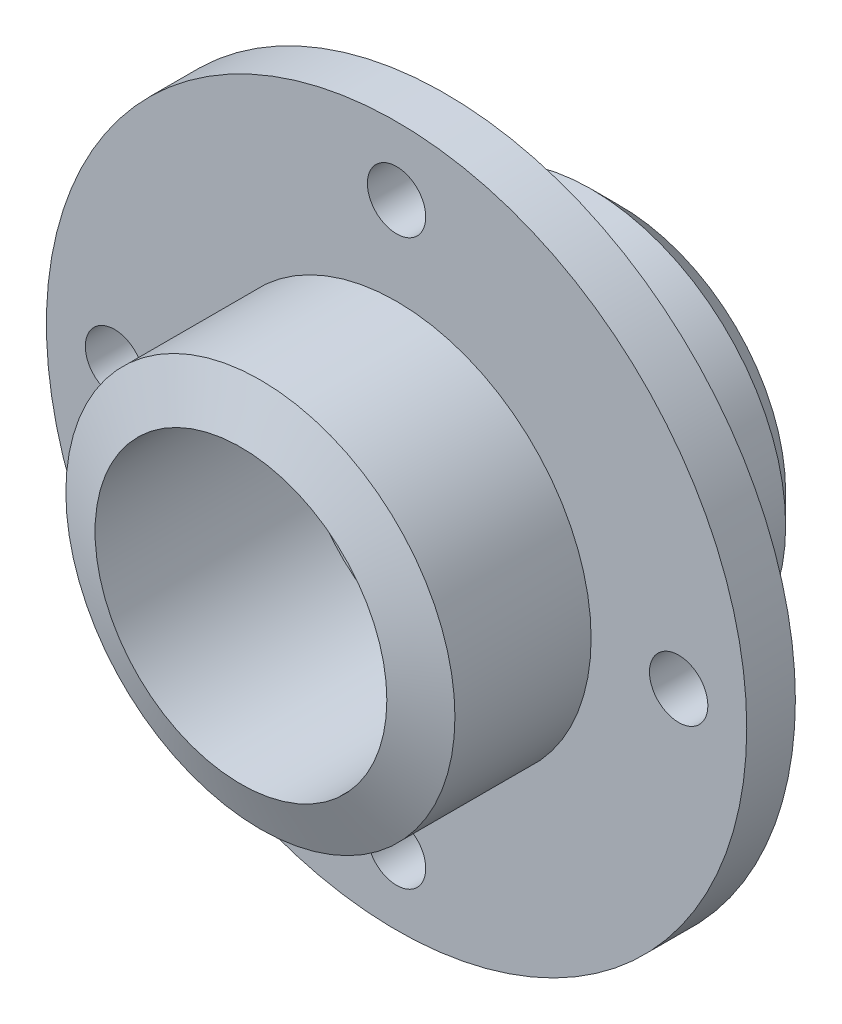
from build123d import *

# Parameters (mm, degrees)
CUT_EXTRUDE1_DEPTH      = 111.145358504
CUT_EXTRUDE1_DEPTH_BACK = 111.145358504
SKETCH2_R               = 6


with BuildPart() as part:
    # Sketch1 → Revolve1 (revolve)
    with BuildSketch(Plane(origin=(0, 0, 0), x_dir=(1, 0, 0), z_dir=(0, 1, 0))):
        Polygon((24, 78), (24, 72), (34, 72), (34, 42), (30, 42), (30, 0), (40, 4), (40, 32), (72, 32), (72, 42), (40, 42), (40, 72), (34, 78), align=None)
    revolve(axis=Axis((0, 0, 0), (0, 0, -1)))

    # Sketch2 → Cut-Extrude1 (cut, two sides: drawn at the far end of the back side and taken through both)
    with BuildSketch(Plane(origin=(0, 0, -42), x_dir=(-1, 0, 0), z_dir=(0, 0, -1)).offset(-CUT_EXTRUDE1_DEPTH_BACK)):
        with Locations((0, 58)):
            Circle(SKETCH2_R)
        with Locations((58, 0)):
            Circle(SKETCH2_R)
        with Locations((0, -58)):
            Circle(SKETCH2_R)
        with Locations((-58, 0)):
            Circle(SKETCH2_R)
    extrude(amount=CUT_EXTRUDE1_DEPTH + CUT_EXTRUDE1_DEPTH_BACK, mode=Mode.SUBTRACT)


solid = part.part
